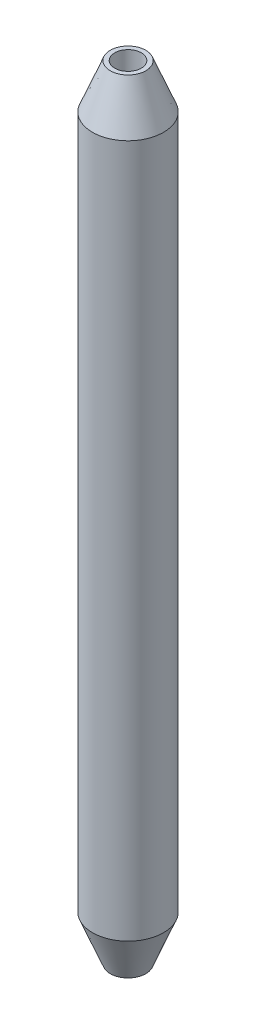
from build123d import *


with BuildPart() as part:
    # Sketch2 → Revolve1 (revolve)
    with BuildSketch(Plane.YZ):
        Polygon((-39, 4), (39, 4), (44, 2), (44, 1.5), (-44, 1.5), (-44, 2), align=None)
    revolve(axis=Axis((0, -38.954399842, 0), (0, 1, 0)))


solid = part.part
